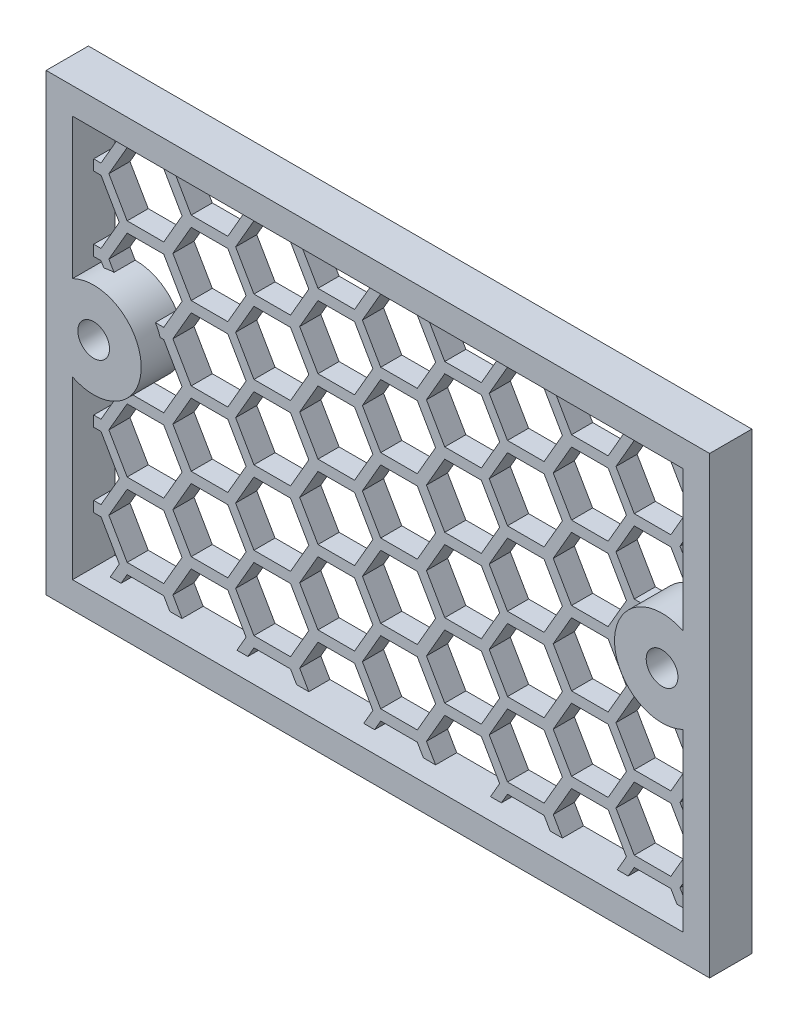
from build123d import *

# Parameters (mm, degrees)
ESBO_O1_W                = 62.8
ESBO_O1_H                = 42.998472327
ESBO_O1_R                = 1.5
RESSALTO_EXTRUS_O1_DEPTH = 2
ESBO_O2_W                = 62.8
ESBO_O2_H                = 42.998472327
ESBO_O2_R                = 1.5
RESSALTO_EXTRUS_O2_DEPTH = 2


with BuildPart() as part:
    # Esboço1 → Ressalto-extrusão1 (new body)
    with BuildSketch(Plane.XY):
        with Locations((-14.101930167, -9.443256808)):
            Rectangle(ESBO_O1_W, ESBO_O1_H)
        with Locations((-41.001930167, -7.789469411)):
            Circle(ESBO_O1_R, mode=Mode.SUBTRACT)
        with Locations((12.798069833, -7.789469411)):
            Circle(ESBO_O1_R, mode=Mode.SUBTRACT)
        Polygon((-21.771803148, -2.943256808), (-23.503853956, -5.943256808), (-21.771803148, -8.943256808), (-18.307701533, -8.943256808), (-16.575650725, -5.943256808), (-18.307701533, -2.943256808), align=None, mode=Mode.SUBTRACT)
        Polygon((-43.001930167, 9.555979355), (-43.001930167, 5.056743192), (-42.307701533, 5.056743192), (-40.575650725, 8.056743192), (-41.441235128, 9.555979355), align=None, mode=Mode.SUBTRACT)
        Polygon((14.798069833, 9.555979355), (14.798069833, 5.056743192), (14.228196852, 5.056743192), (12.496146044, 8.056743192), (13.361730447, 9.555979355), align=None, mode=Mode.SUBTRACT)
        Polygon((-10.637828552, -9.443256808), (-12.369879359, -6.443256808), (-15.833980975, -6.443256808), (-17.566031782, -9.443256808), (-15.833980975, -12.443256808), (-12.369879359, -12.443256808), align=None, mode=Mode.SUBTRACT)
        Polygon((-15.833980975, 0.556743192), (-17.566031782, -2.443256808), (-15.833980975, -5.443256808), (-12.369879359, -5.443256808), (-10.637828552, -2.443256808), (-12.369879359, 0.556743192), align=None, mode=Mode.SUBTRACT)
        Polygon((-15.833980975, 7.556743192), (-17.566031782, 4.556743192), (-15.833980975, 1.556743192), (-12.369879359, 1.556743192), (-10.637828552, 4.556743192), (-12.369879359, 7.556743192), align=None, mode=Mode.SUBTRACT)
        with BuildLine():
            Line((14.798069833, -11.820598285), (14.798069833, -15.943256808))
            Line((14.798069833, -15.943256808), (14.228196852, -15.943256808))
            Line((14.228196852, -15.943256808), (12.496146044, -12.943256808))
            Line((12.496146044, -12.943256808), (12.873980056, -12.288829103))
            ThreePointArc((12.873980056, -12.288829103), (13.862100302, -12.16186454), (14.798069833, -11.820598285))
        make_face(mode=Mode.SUBTRACT)
        Polygon((-16.410890243, 9.555979355), (-15.833980975, 8.556743192), (-12.369879359, 8.556743192), (-11.792970091, 9.555979355), align=None, mode=Mode.SUBTRACT)
        Polygon((14.798069833, 4.056743192), (14.228196852, 4.056743192), (12.496146044, 1.056743192), (14.228196852, -1.943256808), (14.798069833, -1.943256808), align=None, mode=Mode.SUBTRACT)
        with BuildLine():
            Line((14.798069833, -2.943256808), (14.228196852, -2.943256808))
            Line((14.228196852, -2.943256808), (13.942836839, -3.43751485))
            ThreePointArc((13.942836839, -3.43751485), (14.378614726, -3.576171672), (14.798069833, -3.758340537))
            Line((14.798069833, -3.758340537), (14.798069833, -2.943256808))
        make_face(mode=Mode.SUBTRACT)
        Polygon((-15.833980975, -13.443256808), (-17.566031782, -16.443256808), (-15.833980975, -19.443256808), (-12.369879359, -19.443256808), (-10.637828552, -16.443256808), (-12.369879359, -13.443256808), align=None, mode=Mode.SUBTRACT)
        Polygon((-15.833980975, -20.443256808), (-17.566031782, -23.443256808), (-15.833980975, -26.443256808), (-12.369879359, -26.443256808), (-10.637828552, -23.443256808), (-12.369879359, -20.443256808), align=None, mode=Mode.SUBTRACT)
        Polygon((-15.833980975, -27.443256808), (-16.410890243, -28.442492972), (-11.792970091, -28.442492972), (-12.369879359, -27.443256808), align=None, mode=Mode.SUBTRACT)
        Polygon((-43.001930167, -22.943256808), (-42.307701533, -22.943256808), (-40.575650725, -19.943256808), (-42.307701533, -16.943256808), (-43.001930167, -16.943256808), align=None, mode=Mode.SUBTRACT)
        with BuildLine():
            Line((-43.001930167, -2.943256808), (-43.001930167, -3.758340537))
            ThreePointArc((-43.001930167, -3.758340537), (-42.529910399, -3.556825272), (-42.038014734, -3.410368046))
            Line((-42.038014734, -3.410368046), (-42.307701533, -2.943256808))
            Line((-42.307701533, -2.943256808), (-43.001930167, -2.943256808))
        make_face(mode=Mode.SUBTRACT)
        Polygon((-9.771803148, -2.943256808), (-11.503853956, -5.943256808), (-9.771803148, -8.943256808), (-6.307701533, -8.943256808), (-4.575650725, -5.943256808), (-6.307701533, -2.943256808), align=None, mode=Mode.SUBTRACT)
        Polygon((-11.503853956, 1.056743192), (-9.771803148, -1.943256808), (-6.307701533, -1.943256808), (-4.575650725, 1.056743192), (-6.307701533, 4.056743192), (-9.771803148, 4.056743192), align=None, mode=Mode.SUBTRACT)
        Polygon((-11.503853956, 8.056743192), (-9.771803148, 5.056743192), (-6.307701533, 5.056743192), (-4.575650725, 8.056743192), (-5.441235128, 9.555979355), (-10.638269553, 9.555979355), align=None, mode=Mode.SUBTRACT)
        with BuildLine():
            Line((-43.001930167, -15.943256808), (-42.307701533, -15.943256808))
            Line((-42.307701533, -15.943256808), (-40.575650725, -12.943256808))
            Line((-40.575650725, -12.943256808), (-40.953266974, -12.28920628))
            ThreePointArc((-40.953266974, -12.28920628), (-42.005337959, -12.176173505), (-43.001930167, -11.820598285))
            Line((-43.001930167, -11.820598285), (-43.001930167, -15.943256808))
        make_face(mode=Mode.SUBTRACT)
        Polygon((-11.503853956, -12.943256808), (-9.771803148, -15.943256808), (-6.307701533, -15.943256808), (-4.575650725, -12.943256808), (-6.307701533, -9.943256808), (-9.771803148, -9.943256808), align=None, mode=Mode.SUBTRACT)
        Polygon((-11.503853956, -19.943256808), (-9.771803148, -22.943256808), (-6.307701533, -22.943256808), (-4.575650725, -19.943256808), (-6.307701533, -16.943256808), (-9.771803148, -16.943256808), align=None, mode=Mode.SUBTRACT)
        Polygon((-11.503853956, -26.943256808), (-10.638269553, -28.442492972), (-5.441235128, -28.442492972), (-4.575650725, -26.943256808), (-6.307701533, -23.943256808), (-9.771803148, -23.943256808), align=None, mode=Mode.SUBTRACT)
        Polygon((-23.503853956, 1.056743192), (-21.771803148, -1.943256808), (-18.307701533, -1.943256808), (-16.575650725, 1.056743192), (-18.307701533, 4.056743192), (-21.771803148, 4.056743192), align=None, mode=Mode.SUBTRACT)
        Polygon((-23.503853956, 8.056743192), (-21.771803148, 5.056743192), (-18.307701533, 5.056743192), (-16.575650725, 8.056743192), (-17.441235128, 9.555979355), (-22.638269553, 9.555979355), align=None, mode=Mode.SUBTRACT)
        Polygon((-23.503853956, -12.943256808), (-21.771803148, -15.943256808), (-18.307701533, -15.943256808), (-16.575650725, -12.943256808), (-18.307701533, -9.943256808), (-21.771803148, -9.943256808), align=None, mode=Mode.SUBTRACT)
        Polygon((-23.503853956, -19.943256808), (-21.771803148, -22.943256808), (-18.307701533, -22.943256808), (-16.575650725, -19.943256808), (-18.307701533, -16.943256808), (-21.771803148, -16.943256808), align=None, mode=Mode.SUBTRACT)
        Polygon((-23.503853956, -26.943256808), (-22.638269553, -28.442492972), (-17.441235128, -28.442492972), (-16.575650725, -26.943256808), (-18.307701533, -23.943256808), (-21.771803148, -23.943256808), align=None, mode=Mode.SUBTRACT)
        Polygon((-43.001930167, -1.943256808), (-42.307701533, -1.943256808), (-40.575650725, 1.056743192), (-42.307701533, 4.056743192), (-43.001930167, 4.056743192), align=None, mode=Mode.SUBTRACT)
        Polygon((-33.771803148, -2.943256808), (-35.503853956, -5.943256808), (-33.771803148, -8.943256808), (-30.307701533, -8.943256808), (-28.575650725, -5.943256808), (-30.307701533, -2.943256808), align=None, mode=Mode.SUBTRACT)
        Polygon((-35.503853956, 1.056743192), (-33.771803148, -1.943256808), (-30.307701533, -1.943256808), (-28.575650725, 1.056743192), (-30.307701533, 4.056743192), (-33.771803148, 4.056743192), align=None, mode=Mode.SUBTRACT)
        Polygon((-35.503853956, 8.056743192), (-33.771803148, 5.056743192), (-30.307701533, 5.056743192), (-28.575650725, 8.056743192), (-29.441235128, 9.555979355), (-34.638269553, 9.555979355), align=None, mode=Mode.SUBTRACT)
        with BuildLine():
            Line((8.504154181, -6.443256808), (8.166019025, -6.443256808))
            Line((8.166019025, -6.443256808), (6.433968218, -9.443256808))
            Line((6.433968218, -9.443256808), (8.166019025, -12.443256808))
            Line((8.166019025, -12.443256808), (11.630120641, -12.443256808))
            Line((11.630120641, -12.443256808), (11.785532676, -12.174075266))
            ThreePointArc((11.785532676, -12.174075266), (8.892921897, -10.025497049), (8.504154181, -6.443256808))
        make_face(mode=Mode.SUBTRACT)
        Polygon((-35.503853956, -12.943256808), (-33.771803148, -15.943256808), (-30.307701533, -15.943256808), (-28.575650725, -12.943256808), (-30.307701533, -9.943256808), (-33.771803148, -9.943256808), align=None, mode=Mode.SUBTRACT)
        Polygon((-35.503853956, -19.943256808), (-33.771803148, -22.943256808), (-30.307701533, -22.943256808), (-28.575650725, -19.943256808), (-30.307701533, -16.943256808), (-33.771803148, -16.943256808), align=None, mode=Mode.SUBTRACT)
        Polygon((-35.503853956, -26.943256808), (-34.638269553, -28.442492972), (-29.441235128, -28.442492972), (-28.575650725, -26.943256808), (-30.307701533, -23.943256808), (-33.771803148, -23.943256808), align=None, mode=Mode.SUBTRACT)
        Polygon((14.798069833, -16.943256808), (14.228196852, -16.943256808), (12.496146044, -19.943256808), (14.228196852, -22.943256808), (14.798069833, -22.943256808), align=None, mode=Mode.SUBTRACT)
        Polygon((14.798069833, -23.943256808), (14.228196852, -23.943256808), (12.496146044, -26.943256808), (13.361730447, -28.442492972), (14.798069833, -28.442492972), align=None, mode=Mode.SUBTRACT)
        with BuildLine():
            Line((-39.98939301, -12.174075266), (-39.833980975, -12.443256808))
            Line((-39.833980975, -12.443256808), (-36.369879359, -12.443256808))
            Line((-36.369879359, -12.443256808), (-34.637828552, -9.443256808))
            Line((-34.637828552, -9.443256808), (-36.369879359, -6.443256808))
            Line((-36.369879359, -6.443256808), (-36.708014515, -6.443256808))
            ThreePointArc((-36.708014515, -6.443256808), (-37.096782231, -10.025497049), (-39.98939301, -12.174075266))
        make_face(mode=Mode.SUBTRACT)
        Polygon((-43.001930167, -23.943256808), (-43.001930167, -28.442492972), (-41.441235128, -28.442492972), (-40.575650725, -26.943256808), (-42.307701533, -23.943256808), align=None, mode=Mode.SUBTRACT)
        Polygon((-40.410890243, -28.442492972), (-35.792970091, -28.442492972), (-36.369879359, -27.443256808), (-39.833980975, -27.443256808), align=None, mode=Mode.SUBTRACT)
        Polygon((-28.410890243, -28.442492972), (-23.792970091, -28.442492972), (-24.369879359, -27.443256808), (-27.833980975, -27.443256808), align=None, mode=Mode.SUBTRACT)
        Polygon((-4.410890243, -28.442492972), (0.207029909, -28.442492972), (-0.369879359, -27.443256808), (-3.833980975, -27.443256808), align=None, mode=Mode.SUBTRACT)
        Polygon((1.361730447, -28.442492972), (6.558764872, -28.442492972), (7.424349275, -26.943256808), (5.692298467, -23.943256808), (2.228196852, -23.943256808), (0.496146044, -26.943256808), align=None, mode=Mode.SUBTRACT)
        Polygon((7.589109757, -28.442492972), (12.207029909, -28.442492972), (11.630120641, -27.443256808), (8.166019025, -27.443256808), align=None, mode=Mode.SUBTRACT)
        Polygon((7.589109757, 9.555979355), (12.207029909, 9.555979355), (11.630120641, 8.556743192), (8.166019025, 8.556743192), align=None, mode=Mode.SUBTRACT)
        Polygon((2.228196852, -2.943256808), (0.496146044, -5.943256808), (2.228196852, -8.943256808), (5.692298467, -8.943256808), (7.424349275, -5.943256808), (5.692298467, -2.943256808), align=None, mode=Mode.SUBTRACT)
        Polygon((0.496146044, 1.056743192), (2.228196852, -1.943256808), (5.692298467, -1.943256808), (7.424349275, 1.056743192), (5.692298467, 4.056743192), (2.228196852, 4.056743192), align=None, mode=Mode.SUBTRACT)
        Polygon((0.496146044, 8.056743192), (2.228196852, 5.056743192), (5.692298467, 5.056743192), (7.424349275, 8.056743192), (6.558764872, 9.555979355), (1.361730447, 9.555979355), align=None, mode=Mode.SUBTRACT)
        Polygon((0.496146044, -12.943256808), (2.228196852, -15.943256808), (5.692298467, -15.943256808), (7.424349275, -12.943256808), (5.692298467, -9.943256808), (2.228196852, -9.943256808), align=None, mode=Mode.SUBTRACT)
        Polygon((0.496146044, -19.943256808), (2.228196852, -22.943256808), (5.692298467, -22.943256808), (7.424349275, -19.943256808), (5.692298467, -16.943256808), (2.228196852, -16.943256808), align=None, mode=Mode.SUBTRACT)
        Polygon((-4.410890243, 9.555979355), (0.207029909, 9.555979355), (-0.369879359, 8.556743192), (-3.833980975, 8.556743192), align=None, mode=Mode.SUBTRACT)
        Polygon((-28.410890243, 9.555979355), (-23.792970091, 9.555979355), (-24.369879359, 8.556743192), (-27.833980975, 8.556743192), align=None, mode=Mode.SUBTRACT)
        Polygon((-40.410890243, 9.555979355), (-35.792970091, 9.555979355), (-36.369879359, 8.556743192), (-39.833980975, 8.556743192), align=None, mode=Mode.SUBTRACT)
        Polygon((1.362171448, -9.443256808), (-0.369879359, -6.443256808), (-3.833980975, -6.443256808), (-5.566031782, -9.443256808), (-3.833980975, -12.443256808), (-0.369879359, -12.443256808), align=None, mode=Mode.SUBTRACT)
        Polygon((-3.833980975, 0.556743192), (-5.566031782, -2.443256808), (-3.833980975, -5.443256808), (-0.369879359, -5.443256808), (1.362171448, -2.443256808), (-0.369879359, 0.556743192), align=None, mode=Mode.SUBTRACT)
        Polygon((-3.833980975, 7.556743192), (-5.566031782, 4.556743192), (-3.833980975, 1.556743192), (-0.369879359, 1.556743192), (1.362171448, 4.556743192), (-0.369879359, 7.556743192), align=None, mode=Mode.SUBTRACT)
        Polygon((-3.833980975, -13.443256808), (-5.566031782, -16.443256808), (-3.833980975, -19.443256808), (-0.369879359, -19.443256808), (1.362171448, -16.443256808), (-0.369879359, -13.443256808), align=None, mode=Mode.SUBTRACT)
        Polygon((-3.833980975, -20.443256808), (-5.566031782, -23.443256808), (-3.833980975, -26.443256808), (-0.369879359, -26.443256808), (1.362171448, -23.443256808), (-0.369879359, -20.443256808), align=None, mode=Mode.SUBTRACT)
        with BuildLine():
            Line((8.166019025, 0.556743192), (6.433968218, -2.443256808))
            Line((6.433968218, -2.443256808), (8.166019025, -5.443256808))
            Line((8.166019025, -5.443256808), (8.958110664, -5.443256808))
            ThreePointArc((8.958110664, -5.443256808), (10.629563844, -3.846427213), (12.87324779, -3.290097424))
            Line((12.87324779, -3.290097424), (13.362171448, -2.443256808))
            Line((13.362171448, -2.443256808), (11.630120641, 0.556743192))
            Line((11.630120641, 0.556743192), (8.166019025, 0.556743192))
        make_face(mode=Mode.SUBTRACT)
        Polygon((8.166019025, 7.556743192), (6.433968218, 4.556743192), (8.166019025, 1.556743192), (11.630120641, 1.556743192), (13.362171448, 4.556743192), (11.630120641, 7.556743192), align=None, mode=Mode.SUBTRACT)
        Polygon((8.166019025, -13.443256808), (6.433968218, -16.443256808), (8.166019025, -19.443256808), (11.630120641, -19.443256808), (13.362171448, -16.443256808), (11.630120641, -13.443256808), align=None, mode=Mode.SUBTRACT)
        Polygon((8.166019025, -20.443256808), (6.433968218, -23.443256808), (8.166019025, -26.443256808), (11.630120641, -26.443256808), (13.362171448, -23.443256808), (11.630120641, -20.443256808), align=None, mode=Mode.SUBTRACT)
        Polygon((-22.637828552, -9.443256808), (-24.369879359, -6.443256808), (-27.833980975, -6.443256808), (-29.566031782, -9.443256808), (-27.833980975, -12.443256808), (-24.369879359, -12.443256808), align=None, mode=Mode.SUBTRACT)
        Polygon((-27.833980975, 0.556743192), (-29.566031782, -2.443256808), (-27.833980975, -5.443256808), (-24.369879359, -5.443256808), (-22.637828552, -2.443256808), (-24.369879359, 0.556743192), align=None, mode=Mode.SUBTRACT)
        Polygon((-27.833980975, 7.556743192), (-29.566031782, 4.556743192), (-27.833980975, 1.556743192), (-24.369879359, 1.556743192), (-22.637828552, 4.556743192), (-24.369879359, 7.556743192), align=None, mode=Mode.SUBTRACT)
        Polygon((-27.833980975, -13.443256808), (-29.566031782, -16.443256808), (-27.833980975, -19.443256808), (-24.369879359, -19.443256808), (-22.637828552, -16.443256808), (-24.369879359, -13.443256808), align=None, mode=Mode.SUBTRACT)
        Polygon((-27.833980975, -20.443256808), (-29.566031782, -23.443256808), (-27.833980975, -26.443256808), (-24.369879359, -26.443256808), (-22.637828552, -23.443256808), (-24.369879359, -20.443256808), align=None, mode=Mode.SUBTRACT)
        with BuildLine():
            Line((-39.833980975, 0.556743192), (-41.566031782, -2.443256808))
            Line((-41.566031782, -2.443256808), (-41.077108124, -3.290097424))
            ThreePointArc((-41.077108124, -3.290097424), (-38.833424178, -3.846427213), (-37.161970998, -5.443256808))
            Line((-37.161970998, -5.443256808), (-36.369879359, -5.443256808))
            Line((-36.369879359, -5.443256808), (-34.637828552, -2.443256808))
            Line((-34.637828552, -2.443256808), (-36.369879359, 0.556743192))
            Line((-36.369879359, 0.556743192), (-39.833980975, 0.556743192))
        make_face(mode=Mode.SUBTRACT)
        Polygon((-39.833980975, 7.556743192), (-41.566031782, 4.556743192), (-39.833980975, 1.556743192), (-36.369879359, 1.556743192), (-34.637828552, 4.556743192), (-36.369879359, 7.556743192), align=None, mode=Mode.SUBTRACT)
        Polygon((-39.833980975, -13.443256808), (-41.566031782, -16.443256808), (-39.833980975, -19.443256808), (-36.369879359, -19.443256808), (-34.637828552, -16.443256808), (-36.369879359, -13.443256808), align=None, mode=Mode.SUBTRACT)
        Polygon((-39.833980975, -20.443256808), (-41.566031782, -23.443256808), (-39.833980975, -26.443256808), (-36.369879359, -26.443256808), (-34.637828552, -23.443256808), (-36.369879359, -20.443256808), align=None, mode=Mode.SUBTRACT)
    extrude(amount=RESSALTO_EXTRUS_O1_DEPTH)

    # Esboço2 → Ressalto-extrusão2 (add)
    with BuildSketch(Plane.XY.offset(2)):
        with Locations((-14.101930167, -9.443256808)):
            Rectangle(ESBO_O2_W, ESBO_O2_H)
        with Locations((-41.001930167, -7.789469411)):
            Circle(ESBO_O2_R, mode=Mode.SUBTRACT)
        with Locations((12.798069833, -7.789469411)):
            Circle(ESBO_O2_R, mode=Mode.SUBTRACT)
        with BuildLine():
            Line((-43.001930167, -3.758340537), (-43.001930167, 9.555979355))
            Line((-43.001930167, 9.555979355), (14.798069833, 9.555979355))
            Line((14.798069833, 9.555979355), (14.798069833, -3.758340537))
            ThreePointArc((14.798069833, -3.758340537), (8.298069833, -7.789469411), (14.798069833, -11.820598285))
            Line((14.798069833, -11.820598285), (14.798069833, -28.442492972))
            Line((14.798069833, -28.442492972), (-43.001930167, -28.442492972))
            Line((-43.001930167, -28.442492972), (-43.001930167, -11.820598285))
            ThreePointArc((-43.001930167, -11.820598285), (-36.501930167, -7.789469411), (-43.001930167, -3.758340537))
        make_face(mode=Mode.SUBTRACT)
    extrude(amount=RESSALTO_EXTRUS_O2_DEPTH)


solid = part.part
